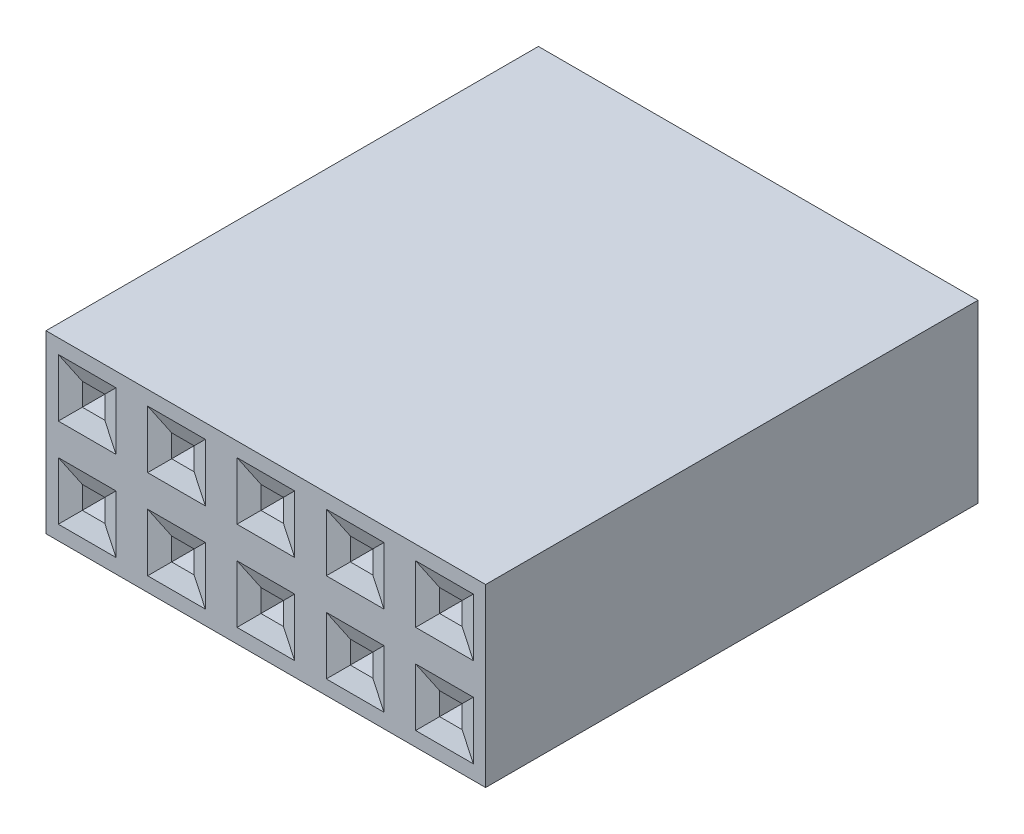
from build123d import *

# Parameters (mm, degrees)
SKETCH1_W           = 12.5
SKETCH1_H           = 14
BOSS_EXTRUDE1_DEPTH = 5
CUT_EXTRUDE1_START  = -4.5
SKETCH3_W           = 0.63999998
SKETCH3_H           = 0.639999981
SKETCH3_W_2         = 0.639999981
CUT_EXTRUDE1_DEPTH  = 4.5
CHAMFER1_SIZE       = 0.5
CHAMFER1_SIZE2      = 0.181985117
SKETCH4_W           = 1.639999981
SKETCH4_H           = 1.639999981
SKETCH4_W_2         = 1.63999998
CUT_EXTRUDE2_DEPTH  = 6


with BuildPart() as part:
    # Sketch1 → Boss-Extrude1 (new body)
    with BuildSketch(Plane(origin=(0, 0, 0), x_dir=(1, 0, 0), z_dir=(0, 1, 0))):
        Rectangle(SKETCH1_W, SKETCH1_H)
    extrude(amount=BOSS_EXTRUDE1_DEPTH)

    # Sketch3 → Cut-Extrude1 (cut)
    with BuildSketch(Plane.XY.offset(7).offset(CUT_EXTRUDE1_START)):
        with Locations((-5.080001681, 1.230026097)):
            Rectangle(SKETCH3_W, SKETCH3_H)
        with Locations((-2.540001758, 1.230026097)):
            Rectangle(SKETCH3_W_2, SKETCH3_H)
        with Locations((-1.834e-06, 1.230026097)):
            Rectangle(SKETCH3_W_2, SKETCH3_H)
        with Locations((2.539998088, 1.230026097)):
            Rectangle(SKETCH3_W_2, SKETCH3_H)
        with Locations((5.079998012, 1.230026097)):
            Rectangle(SKETCH3_W_2, SKETCH3_H)
        with Locations((5.079998012, 3.770026019)):
            Rectangle(SKETCH3_W_2, SKETCH3_H)
        with Locations((2.539998088, 3.770026019)):
            Rectangle(SKETCH3_W_2, SKETCH3_H)
        with Locations((-1.834e-06, 3.770026019)):
            Rectangle(SKETCH3_W_2, SKETCH3_H)
        with Locations((-2.540001758, 3.770026019)):
            Rectangle(SKETCH3_W_2, SKETCH3_H)
        with Locations((-5.080001681, 3.770026019)):
            Rectangle(SKETCH3_W, SKETCH3_H)
    extrude(amount=CUT_EXTRUDE1_DEPTH, mode=Mode.SUBTRACT)

    # Chamfer1
    chamfer1_edges = [part.edges().sort_by_distance(p)[0] for p in [
        (4.759998021, 1.230026096, 7),
        (5.079998011, 0.910026106, 7),
        (2.539998088, 1.550026087, 7),
        (2.219998098, 1.230026096, 7),
        (2.539998088, 0.910026106, 7),
        (2.859998079, 1.230026096, 7),
        (0.319998156, 1.230026096, 7),
        (-1.835e-06, 1.550026087, 7),
        (-0.320001825, 1.230026096, 7),
        (-1.835e-06, 0.910026106, 7),
        (-2.220001767, 1.230026096, 7),
        (-2.540001758, 1.550026087, 7),
        (-2.860001748, 1.230026096, 7),
        (-2.540001758, 0.910026106, 7),
        (-5.080001681, 0.910026106, 7),
        (-4.760001691, 1.230026096, 7),
        (-5.080001681, 1.550026087, 7),
        (-5.400001671, 1.230026096, 7),
        (-5.080001681, 3.450026029, 7),
        (-4.760001691, 3.77002602, 7),
        (-5.080001681, 4.09002601, 7),
        (-5.400001671, 3.77002602, 7),
        (-2.540001758, 4.09002601, 7),
        (-2.860001748, 3.77002602, 7),
        (-2.540001758, 3.450026029, 7),
        (-2.220001767, 3.77002602, 7),
        (0.319998156, 3.77002602, 7),
        (-1.835e-06, 4.09002601, 7),
        (-0.320001825, 3.77002602, 7),
        (-1.835e-06, 3.450026029, 7),
        (2.859998079, 3.77002602, 7),
        (2.539998088, 4.09002601, 7),
        (2.219998098, 3.77002602, 7),
        (2.539998088, 3.450026029, 7),
        (5.079998011, 4.09002601, 7),
        (4.759998021, 3.77002602, 7),
        (5.079998011, 3.450026029, 7),
        (5.399998002, 3.77002602, 7),
        (5.399998002, 1.230026096, 7),
        (5.079998011, 1.550026087, 7),
    ]]
    chamfer1_side = [part.faces().sort_by_distance(p)[0] for p in [
        (1.29e-07, 2.499998172, 7),
    ]]
    chamfer(chamfer1_edges, length=CHAMFER1_SIZE, length2=CHAMFER1_SIZE2, reference=chamfer1_side[0])

    # Sketch4 → Cut-Extrude2 (cut)
    with BuildSketch(Plane(origin=(0, 0, -7), x_dir=(-1, 0, 0), z_dir=(0, 0, -1))):
        with Locations((-5.079998012, 1.230026097)):
            Rectangle(SKETCH4_W, SKETCH4_H)
        with Locations((-2.539998088, 1.230026097)):
            Rectangle(SKETCH4_W, SKETCH4_H)
        with Locations((1.835e-06, 1.230026097)):
            Rectangle(SKETCH4_W, SKETCH4_H)
        with Locations((2.540001758, 1.230026097)):
            Rectangle(SKETCH4_W, SKETCH4_H)
        with Locations((5.080001681, 1.230026097)):
            Rectangle(SKETCH4_W_2, SKETCH4_H)
        with Locations((5.080001681, 3.770026019)):
            Rectangle(SKETCH4_W_2, SKETCH4_H)
        with Locations((2.540001758, 3.770026019)):
            Rectangle(SKETCH4_W, SKETCH4_H)
        with Locations((1.835e-06, 3.770026019)):
            Rectangle(SKETCH4_W, SKETCH4_H)
        with Locations((-2.539998088, 3.770026019)):
            Rectangle(SKETCH4_W, SKETCH4_H)
        with Locations((-5.079998012, 3.770026019)):
            Rectangle(SKETCH4_W, SKETCH4_H)
    extrude(amount=-CUT_EXTRUDE2_DEPTH, mode=Mode.SUBTRACT)


solid = part.part
